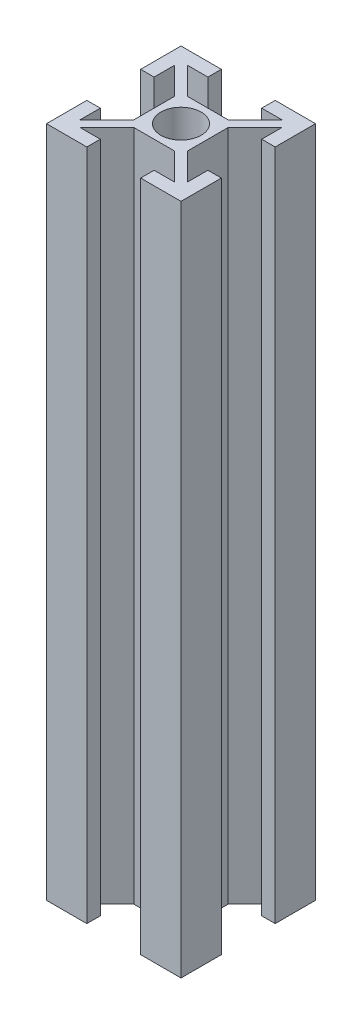
from build123d import *

# Parameters (mm, degrees)
F_2020_SKETCH_R     = 3
BOSS_EXTRUDE1_DEPTH = 100


with BuildPart() as part:
    # 2020 sketch → Boss-Extrude1 (new body)
    with BuildSketch(Plane(origin=(0, 0, 0), x_dir=(1, 0, 0), z_dir=(0, 1, 0))):
        Polygon((-4, 10), (-4, 8), (-7, 8), (-3, 4), (3, 4), (7, 8), (4, 8), (4, 10), (10, 10), (10, 4), (8, 4), (8, 7), (4, 3), (4, -3), (8, -7), (8, -4), (10, -4), (10, -10), (4, -10), (4, -8), (7, -8), (3, -4), (-3, -4), (-7, -8), (-4, -8), (-4, -10), (-10, -10), (-10, -4), (-8, -4), (-8, -7), (-4, -3), (-4, 3), (-8, 7), (-8, 4), (-10, 4), (-10, 10), align=None)
        with Locations(Location((0, 0, 0), (0, 0, 270))):
            Circle(F_2020_SKETCH_R, mode=Mode.SUBTRACT)
    extrude(amount=BOSS_EXTRUDE1_DEPTH)


solid = part.part
